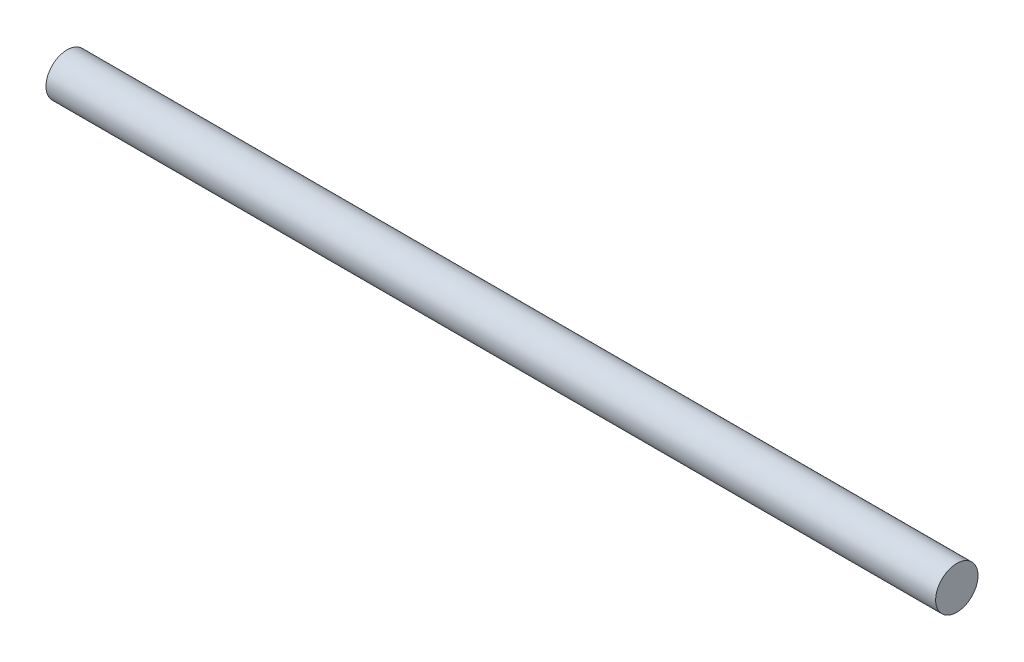
from build123d import *

# Parameters (mm, degrees)
SKETCH1_R           = 4.7625
BOSS_EXTRUDE1_DEPTH = 200


with BuildPart() as part:
    # Sketch1 → Boss-Extrude1 (new body)
    with BuildSketch(Plane(origin=(0, 0, 0), x_dir=(0, 0, -1), z_dir=(1, 0, 0))):
        Circle(SKETCH1_R)
    extrude(amount=BOSS_EXTRUDE1_DEPTH)


solid = part.part
